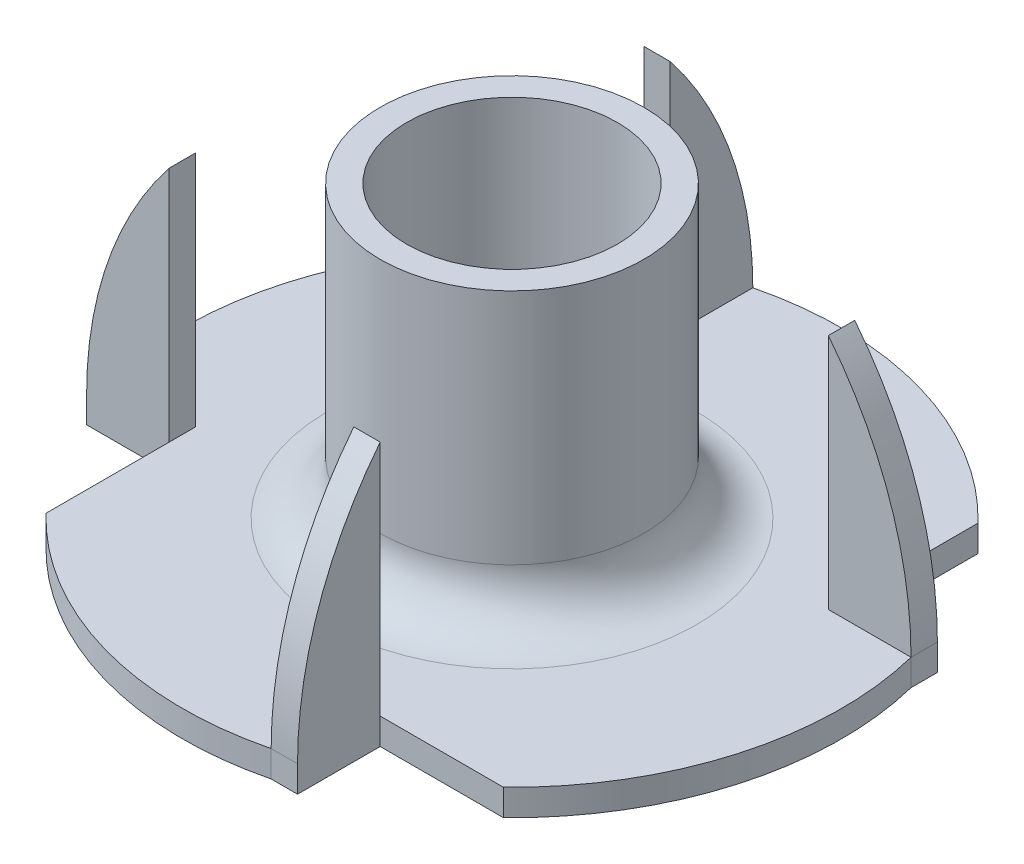
from build123d import *

# Parameters (mm, degrees)
CUT_EXTRUDE2_START  = 1
CUT_EXTRUDE2_DEPTH  = 1
BOSS_EXTRUDE2_DEPTH = 1
CIRPATTERN2_COUNT   = 4


with BuildPart() as part:
    # Sketch1 → Revolve1 (revolve)
    with BuildSketch(Plane(origin=(0, 0, 0), x_dir=(0, 0, -1), z_dir=(1, 0, 0)), mode=Mode.PRIVATE) as revolve1_sk:
        with BuildLine():
            Line((4, 12), (4, 3))
            ThreePointArc((4, 3), (4.878679656, 0.878679656), (7, 0))
            Line((7, 0), (12.5, 0))
            Line((12.5, 0), (12.5, 1))
            Line((12.5, 1), (7, 1))
            ThreePointArc((7, 1), (5.585786438, 1.585786438), (5, 3))
            Line((5, 3), (5, 12))
            Line((5, 12), (4, 12))
        make_face()
    revolve(revolve1_sk.sketch.rotate(Axis((0, 6.966451656, 0), (0, -1, 0)), 180), axis=Axis((0, 6.966451656, 0), (0, -1, 0)))

    # Sketch5 → Cut-Extrude2 (cut)
    with BuildSketch(Plane(origin=(0, 0, 0), x_dir=(1, 0, 0), z_dir=(0, 1, 0)).offset(CUT_EXTRUDE2_START)):
        with BuildLine():
            Line((12.1346611, 3), (9, 3))
            Line((9, 3), (9, 8.674675786))
            ThreePointArc((9, 8.674675786), (10.941616026, 6.044091225), (12.1346611, 3))
        make_face()
        with BuildLine():
            Line((3, -12.1346611), (3, -9))
            Line((3, -9), (8.674675786, -9))
            ThreePointArc((8.674675786, -9), (6.044091225, -10.941616026), (3, -12.1346611))
        make_face()
        with BuildLine():
            Line((-12.1346611, -3), (-9, -3))
            Line((-9, -3), (-9, -8.674675786))
            ThreePointArc((-9, -8.674675786), (-10.941616026, -6.044091225), (-12.1346611, -3))
        make_face()
        with BuildLine():
            Line((-3, 12.1346611), (-3, 9))
            Line((-3, 9), (-8.674675786, 9))
            ThreePointArc((-8.674675786, 9), (-6.044091225, 10.941616026), (-3, 12.1346611))
        make_face()
    extrude(amount=-CUT_EXTRUDE2_DEPTH, mode=Mode.SUBTRACT)

    # Sketch6 → Boss-Extrude2 (add)
    with BuildSketch(Plane.XY.offset(3)):
        with BuildLine():
            Line((-9, 0), (-9, 10))
            ThreePointArc((-9, 10), (-11.328570013, 5.765136415), (-12.1346611, 1))
            Line((-12.1346611, 1), (-12.1346611, 0))
            Line((-12.1346611, 0), (-9, 0))
        make_face()
    boss_extrude2 = extrude(amount=BOSS_EXTRUDE2_DEPTH)

    # CirPattern2: Boss-Extrude2 ×4 about axis
    cirpattern2_axis = Axis((0, 0, 0), (0, 1, 0))
    for i in range(1, CIRPATTERN2_COUNT):
        add(boss_extrude2.rotate(cirpattern2_axis, i * 360 / CIRPATTERN2_COUNT))


solid = part.part
